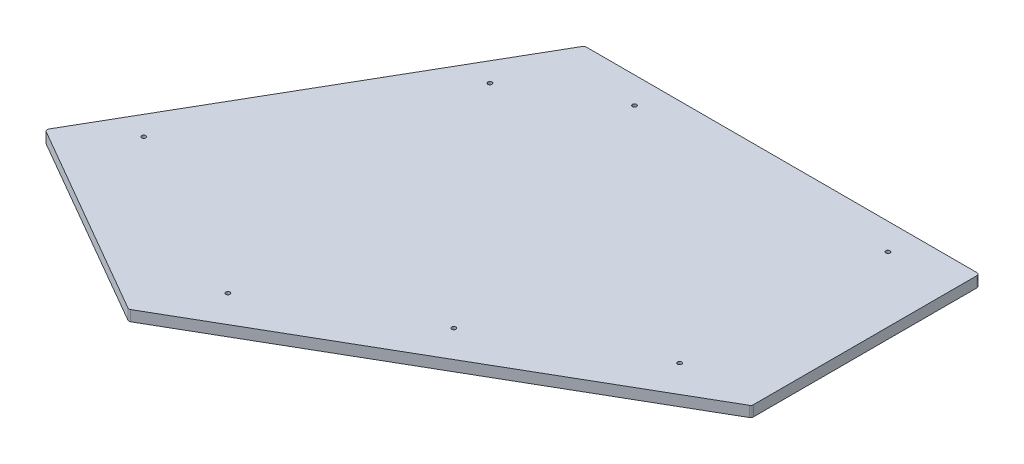
from build123d import *

# Parameters (mm, degrees)
SKETCH1_R           = 2.45745
BOSS_EXTRUDE1_DEPTH = 12.7
FILLET1_R           = 3.175


with BuildPart() as part:
    # Sketch1 → Boss-Extrude1 (new body)
    with BuildSketch(Plane(origin=(0, 0, 0), x_dir=(1, 0, 0), z_dir=(0, 1, 0))):
        Polygon((-0.199185023, -544.98942083), (472.075100704, -272.319932268), (472.075100704, -189.70625), (472.075100704, -89.69375), (472.075100704, 0), (0, 0), (-236.036311861, -408.829744745), (-159.04651881, -453.279511515), (-71.058183894, -504.079244967), align=None)
        with Locations(Location((-169.646411276, -357.338592529, 0), (0, 0, 270))):
            Circle(SKETCH1_R, mode=Mode.SUBTRACT)
        with Locations(Location((-18.164146109, -94.961777227, 0), (0, 0, 270))):
            Circle(SKETCH1_R, mode=Mode.SUBTRACT)
        with Locations(Location((91.321480704, -31.749605568, 0), (0, 0, 270))):
            Circle(SKETCH1_R, mode=Mode.SUBTRACT)
        with Locations(Location((394.287600704, -31.749605568, 0), (0, 0, 270))):
            Circle(SKETCH1_R, mode=Mode.SUBTRACT)
        with Locations(Location((384.876900704, -271.337645568, 0), (0, 0, 270))):
            Circle(SKETCH1_R, mode=Mode.SUBTRACT)
        with Locations(Location((213.713214706, -370.159699049, 0), (0, 0, 270))):
            Circle(SKETCH1_R, mode=Mode.SUBTRACT)
        with Locations(Location((42.549528708, -468.981752529, 0), (0, 0, 270))):
            Circle(SKETCH1_R, mode=Mode.SUBTRACT)
    extrude(amount=BOSS_EXTRUDE1_DEPTH)

    # Fillet1
    fillet1_edges = [part.edges().sort_by_distance(p)[0] for p in [
        (472.075100704, 6.35, 272.319932268),
        (-0.199185023, 6.35, 544.98942083),
        (-236.036311861, 6.35, 408.829744745),
        (0, 6.35, 0),
        (472.075100704, 6.35, 0),
    ]]
    fillet(fillet1_edges, radius=FILLET1_R)


solid = part.part
